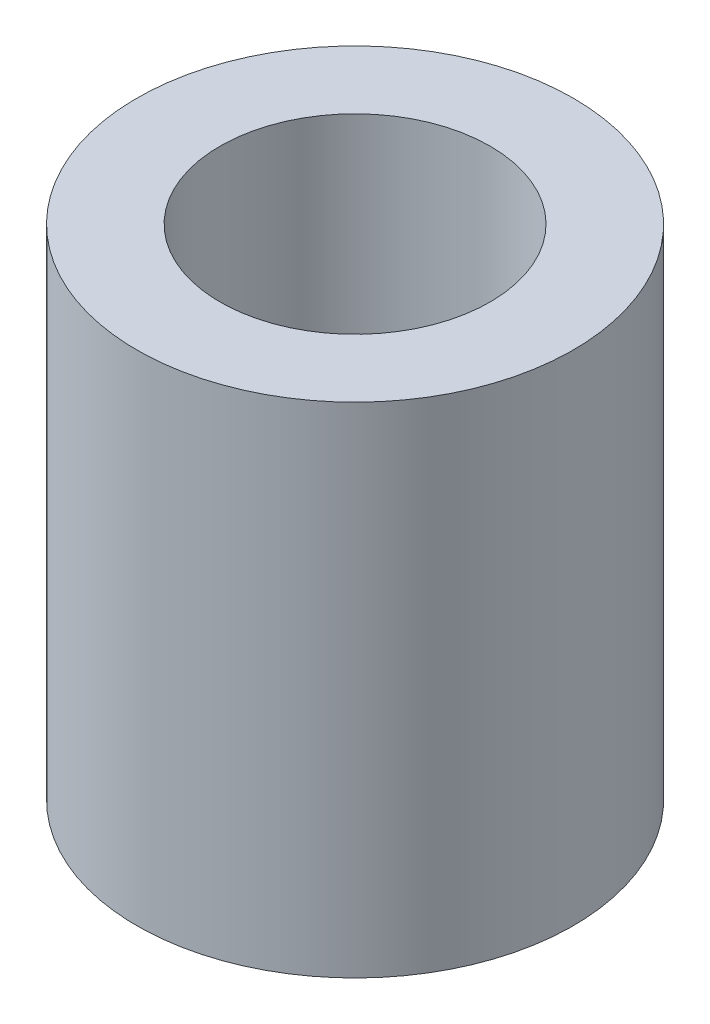
from build123d import *

# Parameters (mm, degrees)
SKETCH1_R           = 33.3375
SKETCH1_R_2         = 20.6375
BOSS_EXTRUDE1_DEPTH = 76.2


with BuildPart() as part:
    # Sketch1 → Boss-Extrude1 (new body)
    with BuildSketch(Plane(origin=(0, 0, 0), x_dir=(1, 0, 0), z_dir=(0, 1, 0))):
        with Locations(Location((0, 0, 0), (0, 0, 90))):
            Circle(SKETCH1_R)
        with Locations(Location((0, 0, 0), (0, 0, 90))):
            Circle(SKETCH1_R_2, mode=Mode.SUBTRACT)
    extrude(amount=BOSS_EXTRUDE1_DEPTH)


solid = part.part
